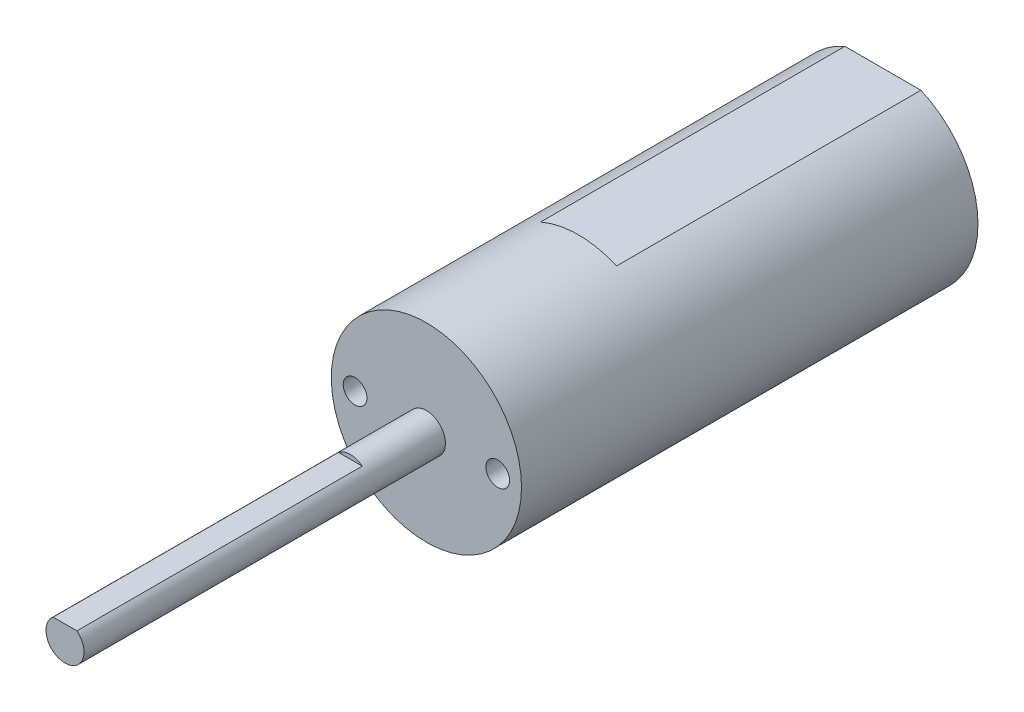
from build123d import *

# Parameters (mm, degrees)
SKETCH1_R           = 10
BOSS_EXTRUDE1_DEPTH = 32
CUT_EXTRUDE1_DEPTH  = 32
SKETCH4_R           = 10
BOSS_EXTRUDE2_DEPTH = 16
SKETCH5_R           = 1.25
CUT_EXTRUDE2_DEPTH  = 6
SKETCH5_3_R         = 2
BOSS_EXTRUDE3_DEPTH = 38
CUT_EXTRUDE3_START  = -30
CUT_EXTRUDE3_DEPTH  = 30


with BuildPart() as part:
    # Sketch1 → Boss-Extrude1 (new body)
    with BuildSketch(Plane.XY):
        Circle(SKETCH1_R)
    extrude(amount=BOSS_EXTRUDE1_DEPTH)

    # Sketch3 → Cut-Extrude1 (cut)
    with BuildSketch(Plane(origin=(0, 0, 0), x_dir=(-1, 0, 0), z_dir=(0, 0, -1))):
        with BuildLine():
            ThreePointArc((4, 9.16515139), (0, 10), (-4, 9.16515139))
            Line((-4, 9.16515139), (4, 9.16515139))
        make_face()
        with BuildLine():
            Line((4, -9.16515139), (-4, -9.16515139))
            ThreePointArc((-4, -9.16515139), (0, -10), (4, -9.16515139))
        make_face()
    extrude(amount=-CUT_EXTRUDE1_DEPTH, mode=Mode.SUBTRACT)

    # Sketch4 → Boss-Extrude2 (add)
    with BuildSketch(Plane.XY.offset(32)):
        Circle(SKETCH4_R)
    extrude(amount=BOSS_EXTRUDE2_DEPTH)

    # Sketch5 → Cut-Extrude2 (cut)
    with BuildSketch(Plane.XY.offset(48)):
        with Locations((-7.5, 0)):
            Circle(SKETCH5_R)
        with Locations((7.5, 0)):
            Circle(SKETCH5_R)
    extrude(amount=-CUT_EXTRUDE2_DEPTH, mode=Mode.SUBTRACT)

    # Sketch5<3> → Boss-Extrude3 (add)
    with BuildSketch(Plane.XY.offset(48)):
        Circle(SKETCH5_3_R)
    extrude(amount=BOSS_EXTRUDE3_DEPTH)

    # Sketch6 → Cut-Extrude3 (cut)
    with BuildSketch(Plane.XY.offset(86).offset(CUT_EXTRUDE3_START)):
        with BuildLine():
            Line((-1.25, 1.5612495), (1.25, 1.5612495))
            ThreePointArc((1.25, 1.5612495), (0, 2), (-1.25, 1.5612495))
        make_face()
    extrude(amount=CUT_EXTRUDE3_DEPTH, mode=Mode.SUBTRACT)


solid = part.part
